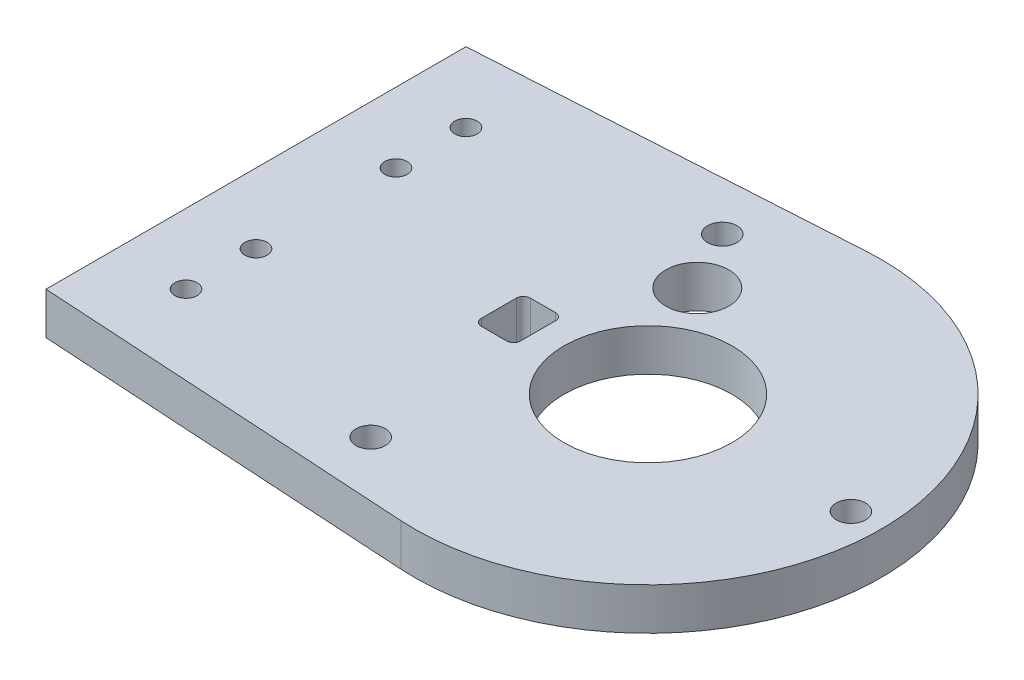
from build123d import *

# Parameters (mm, degrees)
EXTRUDE_1_DEPTH     = 6
SKETCH_4_R          = 12
CUT_EXTRUDE_2_DEPTH = 6
SKETCH_5_R          = 1.6
CUT_EXTRUDE_3_DEPTH = 6
SKETCH_6_R          = 4.5
SKETCH_6_R_2        = 2.1
CUT_EXTRUDE_4_DEPTH = 6
SKETCH_7_W          = 5.6
SKETCH_7_H          = 7
CUT_EXTRUDE_5_DEPTH = 6
FILLET_2_R          = 1


with BuildPart() as part:
    # 草图1 → 凸台-拉伸1 (new body)
    with BuildSketch(Plane(origin=(0, 0, 0), x_dir=(1, 0, 0), z_dir=(0, 1, 0))):
        with BuildLine():
            Line((-56, -30), (-56, 30))
            Line((-56, 30), (-2.028111517, 33.288275168))
            ThreePointArc((-2.028111517, 33.288275168), (33.35, 0), (-2.028111517, -33.288275168))
            Line((-2.028111517, -33.288275168), (-56, -30))
        make_face()
    extrude(amount=EXTRUDE_1_DEPTH)

    # 草图4 → 切除-拉伸2 (cut)
    with BuildSketch(Plane(origin=(0, 6, 0), x_dir=(1, 0, 0), z_dir=(0, 1, 0))):
        with Locations(Location((0, 0, 0), (0, 0, 270))):
            Circle(SKETCH_4_R)
    extrude(amount=-CUT_EXTRUDE_2_DEPTH, mode=Mode.SUBTRACT)

    # 草图5 → 切除-拉伸3 (cut)
    with BuildSketch(Plane(origin=(0, 6, 0), x_dir=(1, 0, 0), z_dir=(0, 1, 0))):
        with Locations(Location((-46, 20, 0), (0, 0, 270))):
            Circle(SKETCH_5_R)
        with Locations(Location((-46, 10, 0), (0, 0, 270))):
            Circle(SKETCH_5_R)
        with Locations(Location((-46, -20, 0), (0, 0, 90))):
            Circle(SKETCH_5_R)
        with Locations(Location((-46, -10, 0), (0, 0, 90))):
            Circle(SKETCH_5_R)
    extrude(amount=-CUT_EXTRUDE_3_DEPTH, mode=Mode.SUBTRACT)

    # 草图6 → 切除-拉伸4 (cut)
    with BuildSketch(Plane(origin=(0, 6, 0), x_dir=(1, 0, 0), z_dir=(0, 1, 0))):
        with Locations(Location((-9.625, 16.670989023, 0), (0, 0, 270))):
            Circle(SKETCH_6_R)
        with Locations(Location((29, 0, 0), (0, 0, 270))):
            Circle(SKETCH_6_R_2)
        with Locations(Location((-14.5, -25.11473671, 0), (0, 0, 270))):
            Circle(SKETCH_6_R_2)
        with Locations(Location((-14.5, 25.11473671, 0), (0, 0, 270))):
            Circle(SKETCH_6_R_2)
    extrude(amount=-CUT_EXTRUDE_4_DEPTH, mode=Mode.SUBTRACT)

    # 草图7 → 切除-拉伸5 (cut)
    with BuildSketch(Plane(origin=(0, 6, 0), x_dir=(1, 0, 0), z_dir=(0, 1, 0))):
        with Locations((-18.5, 0)):
            Rectangle(SKETCH_7_W, SKETCH_7_H)
    extrude(amount=-CUT_EXTRUDE_5_DEPTH, mode=Mode.SUBTRACT)

    # 圆角2
    fillet_2_edges = [part.edges().sort_by_distance(p)[0] for p in [
        (-15.7, 3, 3.5),
        (-15.7, 3, -3.5),
        (-21.3, 3, -3.5),
        (-21.3, 3, 3.5),
    ]]
    fillet(fillet_2_edges, radius=FILLET_2_R)


solid = part.part
